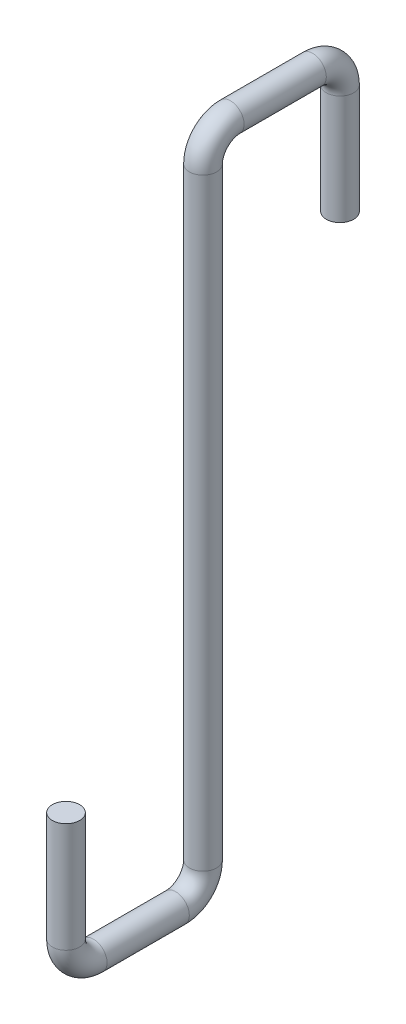
from build123d import *

# Parameters (mm, degrees)
SWEEP1_PROFILE_R = 0.5


with BuildPart() as part:
    # Sweep1: sweep along a curve in space
    with BuildLine() as sweep1_path:
        Line((0, -1, -2.5), (0, -5, -2.5))
        ThreePointArc((0, 0, -1.5), (0, -0.292893219, -2.207106781), (0, -1, -2.5))
        Line((0, 0, -1.5), (0, 0, 1.5))
        ThreePointArc((0, 0, 1.5), (0, -0.292893219, 2.207106781), (0, -1, 2.5))
        Line((0, -1, 2.5), (0, -23, 2.5))
        ThreePointArc((0, -23, 2.5), (0, -23.707106781, 2.792893219), (0, -24, 3.5))
        Line((0, -24, 3.5), (0, -24, 6.5))
        ThreePointArc((0, -24, 6.5), (0, -23.707106781, 7.207106781), (0, -23, 7.5))
        Line((0, -23, 7.5), (0, -19, 7.5))
    # Sweep1 profile (on start of the path) → Sweep1 (sweep)
    with BuildSketch(Plane(origin=(0, -19, 7.5), x_dir=(0, 0, -1), z_dir=(0, -1, 0))):
        Circle(SWEEP1_PROFILE_R)
    sweep(path=sweep1_path.line)


solid = part.part
